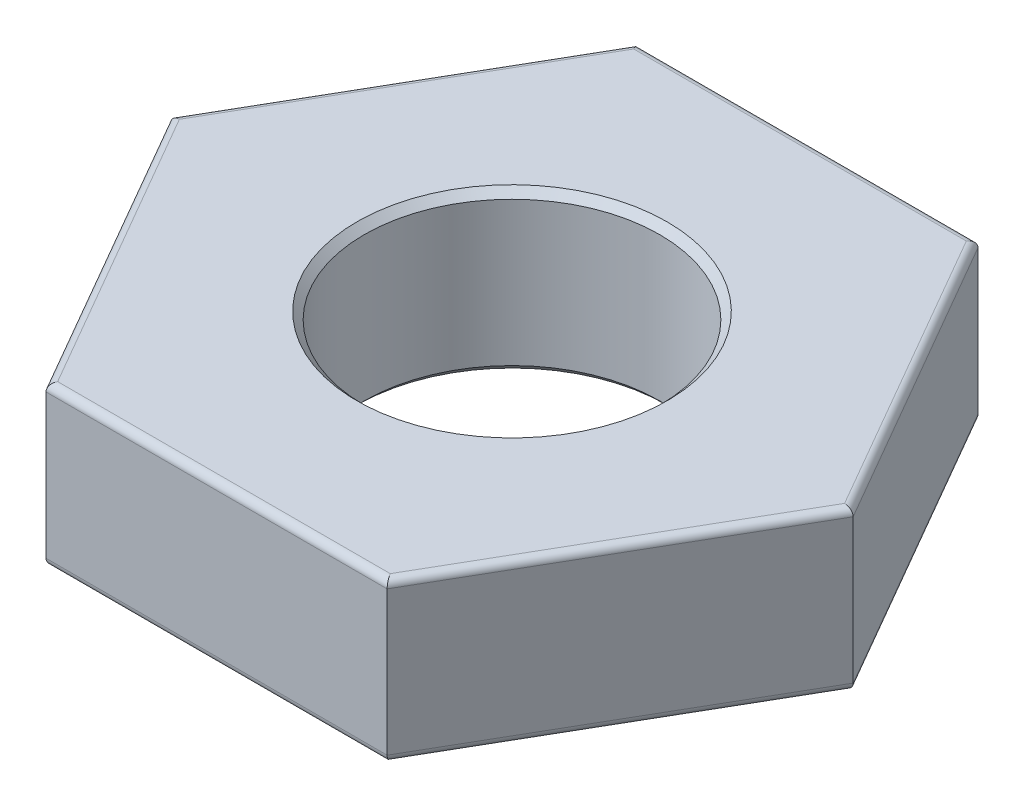
from build123d import *

# Parameters (mm, degrees)
SKETCH1_R           = 2
BOSS_EXTRUDE1_DEPTH = 2.15
FILLET1_R           = 0.1
CHAMFER1_SIZE       = 0.1


with BuildPart() as part:
    # Sketch1 → Boss-Extrude1 (new body)
    with BuildSketch(Plane(origin=(0, 0, 0), x_dir=(1, 0, 0), z_dir=(0, 1, 0))):
        Polygon((-2.309401077, 4), (2.309401077, 4), (4.618802154, 0), (2.309401077, -4), (-2.309401077, -4), (-4.618802154, 0), align=None)
        with Locations(Location((0, 0, 0), (0, 0, 90))):
            Circle(SKETCH1_R, mode=Mode.SUBTRACT)
    extrude(amount=BOSS_EXTRUDE1_DEPTH)

    # Fillet1
    fillet1_edges = [part.edges().sort_by_distance(p)[0] for p in [
        (3.464101615, 2.15, -2),
        (3.464101615, 2.15, 2),
        (0, 2.15, 4),
        (-3.464101615, 2.15, 2),
        (-3.464101615, 2.15, -2),
        (-3.464101615, 0, 2),
        (0, 0, 4),
        (3.464101615, 0, 2),
        (3.464101615, 0, -2),
        (0, 0, -4),
        (-3.464101615, 0, -2),
        (0, 2.15, -4),
    ]]
    fillet(fillet1_edges, radius=FILLET1_R)

    # Chamfer1
    chamfer1_edges = [part.edges().sort_by_distance(p)[0] for p in [
        (0, 0, 2),
        (0, 2.15, 2),
    ]]
    chamfer(chamfer1_edges, length=CHAMFER1_SIZE)


solid = part.part
